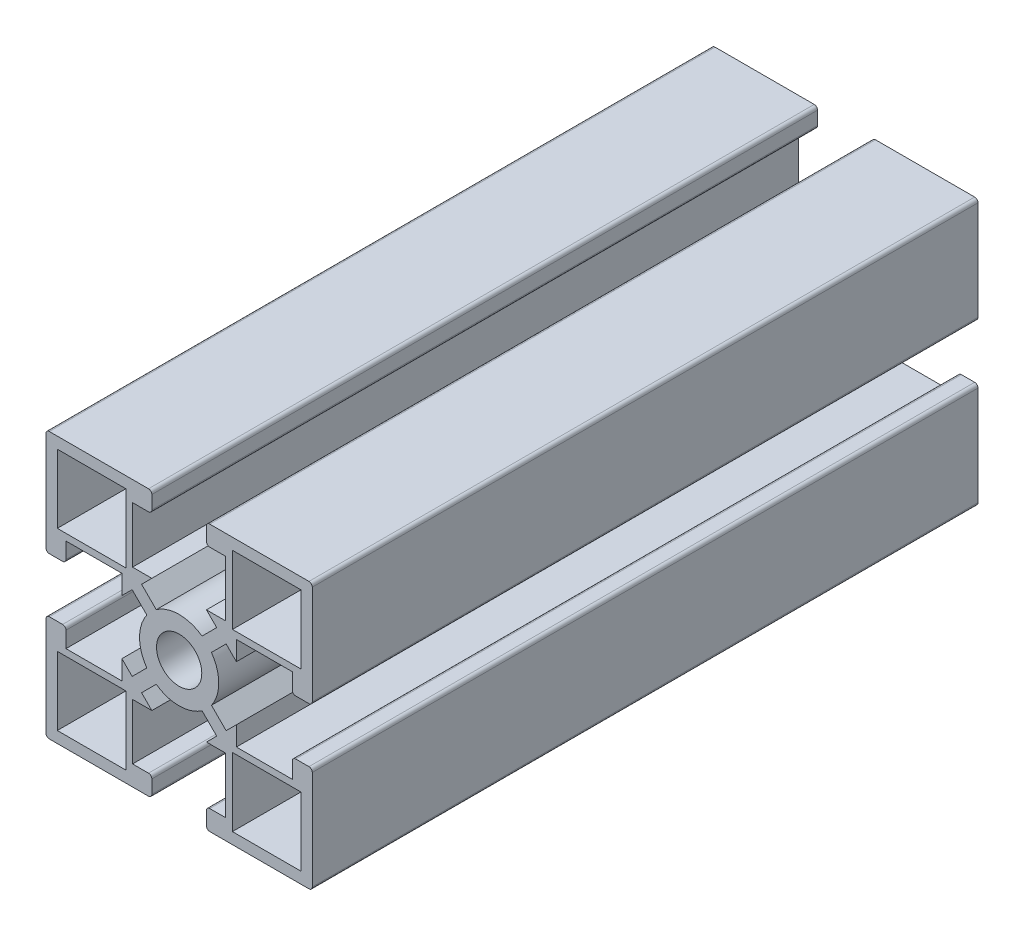
from build123d import *

# Parameters (mm, degrees)
SKETCH_1_R      = 3.4
SKETCH_1_W      = 10.3
SKETCH_1_H      = 10.3
EXTRUDE_1_DEPTH = 100


with BuildPart() as part:
    # 草图1 → 凸台-拉伸1 (new body)
    with BuildSketch(Plane.XY):
        with BuildLine():
            Line((-4.582808051, 8.751402525), (-7.482808051, 8.751402525))
            Line((-7.482808051, 8.751402525), (-7.482808051, 17.151402525))
            Line((-7.482808051, 17.151402525), (-5.082808051, 17.151402525))
            ThreePointArc((-5.082808051, 17.151402525), (-4.72925466, 17.297849134), (-4.582808051, 17.651402525))
            Line((-4.582808051, 17.651402525), (-4.582808051, 19.651402525))
            ThreePointArc((-4.582808051, 19.651402525), (-4.72925466, 20.004955915), (-5.082808051, 20.151402525))
            Line((-5.082808051, 20.151402525), (-19.982808051, 20.151402525))
            ThreePointArc((-19.982808051, 20.151402525), (-20.336361441, 20.004955915), (-20.482808051, 19.651402525))
            Line((-20.482808051, 19.651402525), (-20.482808051, 4.751402525))
            ThreePointArc((-20.482808051, 4.751402525), (-20.336361441, 4.397849134), (-19.982808051, 4.251402525))
            Line((-19.982808051, 4.251402525), (-17.982808051, 4.251402525))
            ThreePointArc((-17.982808051, 4.251402525), (-17.62925466, 4.397849134), (-17.482808051, 4.751402525))
            Line((-17.482808051, 4.751402525), (-17.482808051, 7.151402525))
            Line((-17.482808051, 7.151402525), (-9.082808051, 7.151402525))
            Line((-9.082808051, 7.151402525), (-9.082808051, 4.251402525))
            Line((-9.082808051, 4.251402525), (-7.539914832, 5.794295743))
            Line((-7.539914832, 5.794295743), (-5.337353801, 3.591734712))
            ThreePointArc((-5.337353801, 3.591734712), (-6.432808051, 0.151402525), (-5.337353801, -3.288929663))
            Line((-5.337353801, -3.288929663), (-7.539914832, -5.491490694))
            Line((-7.539914832, -5.491490694), (-9.082808051, -3.948597475))
            Line((-9.082808051, -3.948597475), (-9.082808051, -6.848597475))
            Line((-9.082808051, -6.848597475), (-17.482808051, -6.848597475))
            Line((-17.482808051, -6.848597475), (-17.482808051, -4.448597475))
            ThreePointArc((-17.482808051, -4.448597475), (-17.62925466, -4.095044085), (-17.982808051, -3.948597475))
            Line((-17.982808051, -3.948597475), (-19.982808051, -3.948597475))
            ThreePointArc((-19.982808051, -3.948597475), (-20.336361441, -4.095044085), (-20.482808051, -4.448597475))
            Line((-20.482808051, -4.448597475), (-20.482808051, -19.348597475))
            ThreePointArc((-20.482808051, -19.348597475), (-20.336361441, -19.702150866), (-19.982808051, -19.848597475))
            Line((-19.982808051, -19.848597475), (-5.082808051, -19.848597475))
            ThreePointArc((-5.082808051, -19.848597475), (-4.72925466, -19.702150866), (-4.582808051, -19.348597475))
            Line((-4.582808051, -19.348597475), (-4.582808051, -17.348597475))
            ThreePointArc((-4.582808051, -17.348597475), (-4.72925466, -16.995044085), (-5.082808051, -16.848597475))
            Line((-5.082808051, -16.848597475), (-7.482808051, -16.848597475))
            Line((-7.482808051, -16.848597475), (-7.482808051, -8.448597475))
            Line((-7.482808051, -8.448597475), (-4.582808051, -8.448597475))
            Line((-4.582808051, -8.448597475), (-6.125701269, -6.905704257))
            Line((-6.125701269, -6.905704257), (-3.923140238, -4.703143225))
            ThreePointArc((-3.923140238, -4.703143225), (-0.482808051, -5.798597475), (2.957524137, -4.703143225))
            Line((2.957524137, -4.703143225), (5.160085168, -6.905704257))
            Line((5.160085168, -6.905704257), (3.617191949, -8.448597475))
            Line((3.617191949, -8.448597475), (6.517191949, -8.448597475))
            Line((6.517191949, -8.448597475), (6.517191949, -16.848597475))
            Line((6.517191949, -16.848597475), (4.117191949, -16.848597475))
            ThreePointArc((4.117191949, -16.848597475), (3.763638559, -16.995044085), (3.617191949, -17.348597475))
            Line((3.617191949, -17.348597475), (3.617191949, -19.348597475))
            ThreePointArc((3.617191949, -19.348597475), (3.763638559, -19.702150866), (4.117191949, -19.848597475))
            Line((4.117191949, -19.848597475), (19.017191949, -19.848597475))
            ThreePointArc((19.017191949, -19.848597475), (19.37074534, -19.702150866), (19.517191949, -19.348597475))
            Line((19.517191949, -19.348597475), (19.517191949, -4.448597475))
            ThreePointArc((19.517191949, -4.448597475), (19.37074534, -4.095044085), (19.017191949, -3.948597475))
            Line((19.017191949, -3.948597475), (17.017191949, -3.948597475))
            ThreePointArc((17.017191949, -3.948597475), (16.663638559, -4.095044085), (16.517191949, -4.448597475))
            Line((16.517191949, -4.448597475), (16.517191949, -6.848597475))
            Line((16.517191949, -6.848597475), (8.117191949, -6.848597475))
            Line((8.117191949, -6.848597475), (8.117191949, -3.948597475))
            Line((8.117191949, -3.948597475), (6.574298731, -5.491490694))
            Line((6.574298731, -5.491490694), (4.371737699, -3.288929663))
            ThreePointArc((4.371737699, -3.288929663), (5.467191949, 0.151402525), (4.371737699, 3.591734712))
            Line((4.371737699, 3.591734712), (6.574298731, 5.794295743))
            Line((6.574298731, 5.794295743), (8.117191949, 4.251402525))
            Line((8.117191949, 4.251402525), (8.117191949, 7.151402525))
            Line((8.117191949, 7.151402525), (16.517191949, 7.151402525))
            Line((16.517191949, 7.151402525), (16.517191949, 4.751402525))
            ThreePointArc((16.517191949, 4.751402525), (16.663638559, 4.397849134), (17.017191949, 4.251402525))
            Line((17.017191949, 4.251402525), (19.017191949, 4.251402525))
            ThreePointArc((19.017191949, 4.251402525), (19.37074534, 4.397849134), (19.517191949, 4.751402525))
            Line((19.517191949, 4.751402525), (19.517191949, 19.651402525))
            ThreePointArc((19.517191949, 19.651402525), (19.37074534, 20.004955915), (19.017191949, 20.151402525))
            Line((19.017191949, 20.151402525), (4.117191949, 20.151402525))
            ThreePointArc((4.117191949, 20.151402525), (3.763638559, 20.004955915), (3.617191949, 19.651402525))
            Line((3.617191949, 19.651402525), (3.617191949, 17.651402525))
            ThreePointArc((3.617191949, 17.651402525), (3.763638559, 17.297849134), (4.117191949, 17.151402525))
            Line((4.117191949, 17.151402525), (6.517191949, 17.151402525))
            Line((6.517191949, 17.151402525), (6.517191949, 8.751402525))
            Line((6.517191949, 8.751402525), (3.617191949, 8.751402525))
            Line((3.617191949, 8.751402525), (5.160085168, 7.208509306))
            Line((5.160085168, 7.208509306), (2.957524137, 5.005948275))
            ThreePointArc((2.957524137, 5.005948275), (-0.482808051, 6.101402525), (-3.923140238, 5.005948275))
            Line((-3.923140238, 5.005948275), (-6.125701269, 7.208509306))
            Line((-6.125701269, 7.208509306), (-4.582808051, 8.751402525))
        make_face()
        with Locations((-0.482808051, 0.151402525)):
            Circle(SKETCH_1_R, mode=Mode.SUBTRACT)
        with Locations((-13.632808051, 13.301402525)):
            Rectangle(SKETCH_1_W, SKETCH_1_H, mode=Mode.SUBTRACT)
        with Locations((12.667191949, 13.301402525)):
            Rectangle(SKETCH_1_W, SKETCH_1_H, mode=Mode.SUBTRACT)
        with Locations((-13.632808051, -12.998597475)):
            Rectangle(SKETCH_1_W, SKETCH_1_H, mode=Mode.SUBTRACT)
        with Locations((12.667191949, -12.998597475)):
            Rectangle(SKETCH_1_W, SKETCH_1_H, mode=Mode.SUBTRACT)
    extrude(amount=EXTRUDE_1_DEPTH)


solid = part.part
